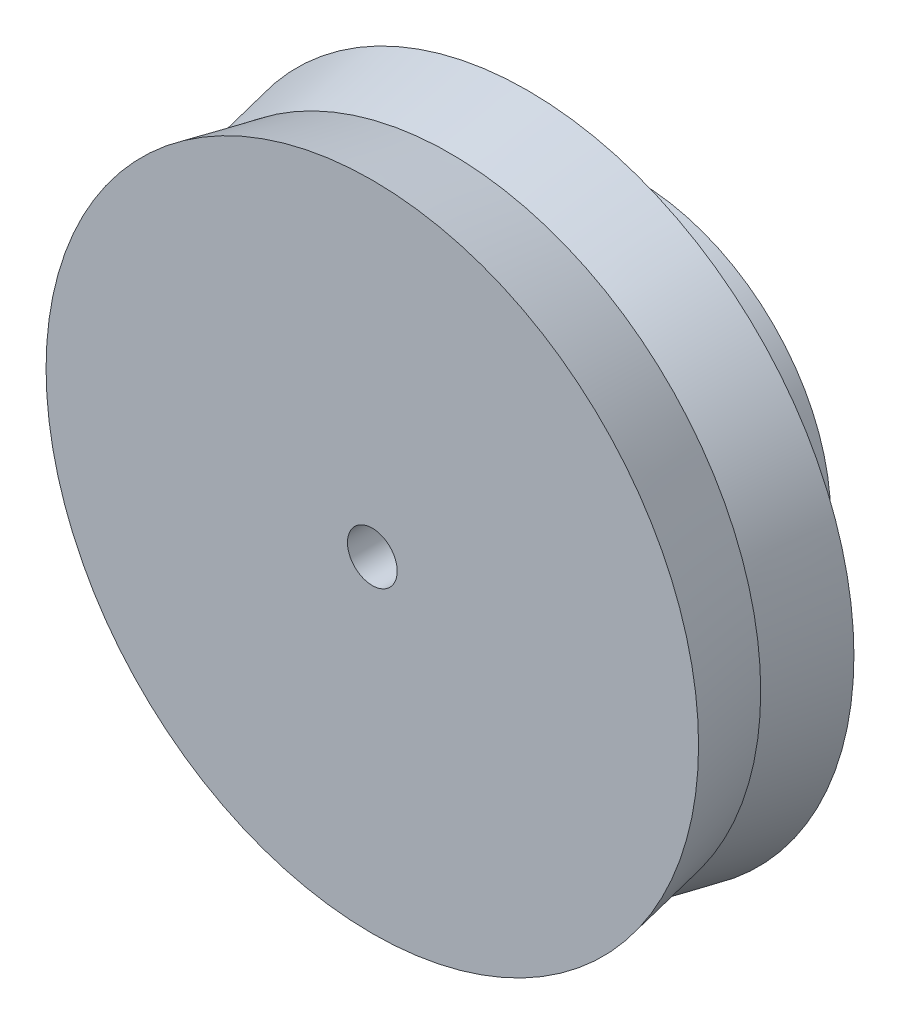
from build123d import *

# Parameters (mm, degrees)
SKETCH4_R               = 12.5
BOSS_EXTRUDE1_DEPTH     = 7
CUT_EXTRUDE1_DEPTH      = 32.336879232
CUT_EXTRUDE1_DEPTH_BACK = 32.336879232
SKETCH3_R               = 1.6
CUT_EXTRUDE2_DEPTH      = 33.031234756
CUT_EXTRUDE2_DEPTH_BACK = 33.031234756
SKETCH5_R               = 1.65
CUT_EXTRUDE3_DEPTH      = 2.7
CUT_EXTRUDE4_DEPTH      = 2.7


with BuildPart() as part:
    # Sketch2 → Revolve1 (revolve)
    with BuildSketch(Plane(origin=(0, 0, 0), x_dir=(1, 0, 0), z_dir=(0, 1, 0)), mode=Mode.PRIVATE) as revolve1_sk:
        Polygon((0, 5), (0, -5), (21, -5), (20, 0), (21, 5), align=None)
    revolve(revolve1_sk.sketch.rotate(Axis((0, 0, -5), (0, 0, 1)), 180), axis=Axis((0, 0, -5), (0, 0, 1)))

    # Sketch4 → Boss-Extrude1 (add)
    with BuildSketch(Plane(origin=(0, 0, -5), x_dir=(-1, 0, 0), z_dir=(0, 0, -1))):
        with Locations(Location((0, 0, 0), (0, 0, 180))):
            Circle(SKETCH4_R)
    extrude(amount=BOSS_EXTRUDE1_DEPTH)

    # Sketch3 → Cut-Extrude1 (cut, two sides: drawn at the far end of the back side and taken through both)
    with BuildSketch(Plane(origin=(0, 0, -5), x_dir=(-1, 0, 0), z_dir=(0, 0, -1)).offset(-CUT_EXTRUDE1_DEPTH_BACK)):
        Circle(SKETCH3_R)
    extrude(amount=CUT_EXTRUDE1_DEPTH + CUT_EXTRUDE1_DEPTH_BACK, mode=Mode.SUBTRACT)

    # Sketch5 → Cut-Extrude2 (cut, two sides: drawn at the far end of the back side and taken through both)
    with BuildSketch(Plane(origin=(0, 0, 0), x_dir=(0, 0, -1), z_dir=(1, 0, 0)).offset(-CUT_EXTRUDE2_DEPTH_BACK)):
        with Locations((8.5, 0)):
            Circle(SKETCH5_R)
    extrude(amount=CUT_EXTRUDE2_DEPTH + CUT_EXTRUDE2_DEPTH_BACK, mode=Mode.SUBTRACT)

    # Sketch6 → Cut-Extrude3 (cut)
    with BuildSketch(Plane(origin=(-3.2, 0, 0), x_dir=(0, 0, -1), z_dir=(1, 0, 0))):
        Polygon((10.145448267, 2.85), (12, 2.85), (12, -2.85), (10.145448267, -2.85), (6.854551733, -2.85), (5.209103466, 0), (6.854551733, 2.85), align=None)
    extrude(amount=-CUT_EXTRUDE3_DEPTH, mode=Mode.SUBTRACT)

    # Sketch7 → Cut-Extrude4 (cut)
    with BuildSketch(Plane(origin=(3.2, 0, 0), x_dir=(0, 0, -1), z_dir=(1, 0, 0))):
        Polygon((12, 2.85), (10.145448267, 2.85), (6.854551733, 2.85), (5.209103466, 0), (6.854551733, -2.85), (10.145448267, -2.85), (12, -2.85), align=None)
    extrude(amount=CUT_EXTRUDE4_DEPTH, mode=Mode.SUBTRACT)


solid = part.part
